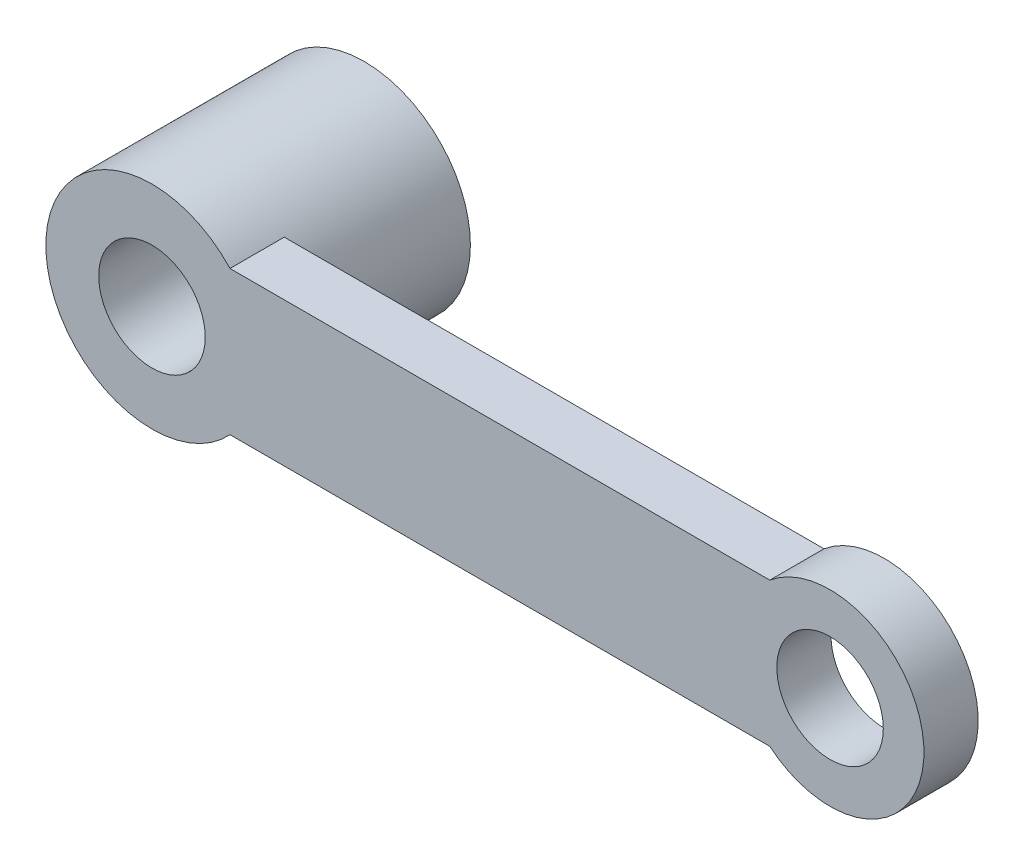
from build123d import *

# Parameters (mm, degrees)
CROQUIS1_R              = 5.105
SALIENTE_EXTRUIR1_DEPTH = 5.2
SALIENTE_EXTRUIR2_START = -15.15
CROQUIS1_3_R            = 5.105
SALIENTE_EXTRUIR2_DEPTH = 15.15


with BuildPart() as part:
    # Croquis1 → Saliente-Extruir1 (new body)
    with BuildSketch(Plane.XY):
        with BuildLine():
            Line((59.221591915, 6.9), (7.478009428, 6.9))
            ThreePointArc((7.478009428, 6.9), (-10.175, 0), (7.478009428, -6.9))
            Line((7.478009428, -6.9), (59.221591915, -6.9))
            ThreePointArc((59.221591915, -6.9), (74, 0), (59.221591915, 6.9))
        make_face()
        with Locations((65, 0)):
            Circle(CROQUIS1_R, mode=Mode.SUBTRACT)
        Circle(CROQUIS1_R, mode=Mode.SUBTRACT)
    extrude(amount=SALIENTE_EXTRUIR1_DEPTH)

    # Croquis1<3> → Saliente-Extruir2 (add)
    with BuildSketch(Plane.XY.offset(SALIENTE_EXTRUIR2_START)):
        with BuildLine():
            ThreePointArc((10.175, 0), (9.476797215, 3.704178659), (7.478009428, 6.9))
            ThreePointArc((7.478009428, 6.9), (-10.175, 0), (7.478009428, -6.9))
            ThreePointArc((7.478009428, -6.9), (9.476797215, -3.704178659), (10.175, 0))
        make_face()
        Circle(CROQUIS1_3_R, mode=Mode.SUBTRACT)
    extrude(amount=SALIENTE_EXTRUIR2_DEPTH)


solid = part.part
